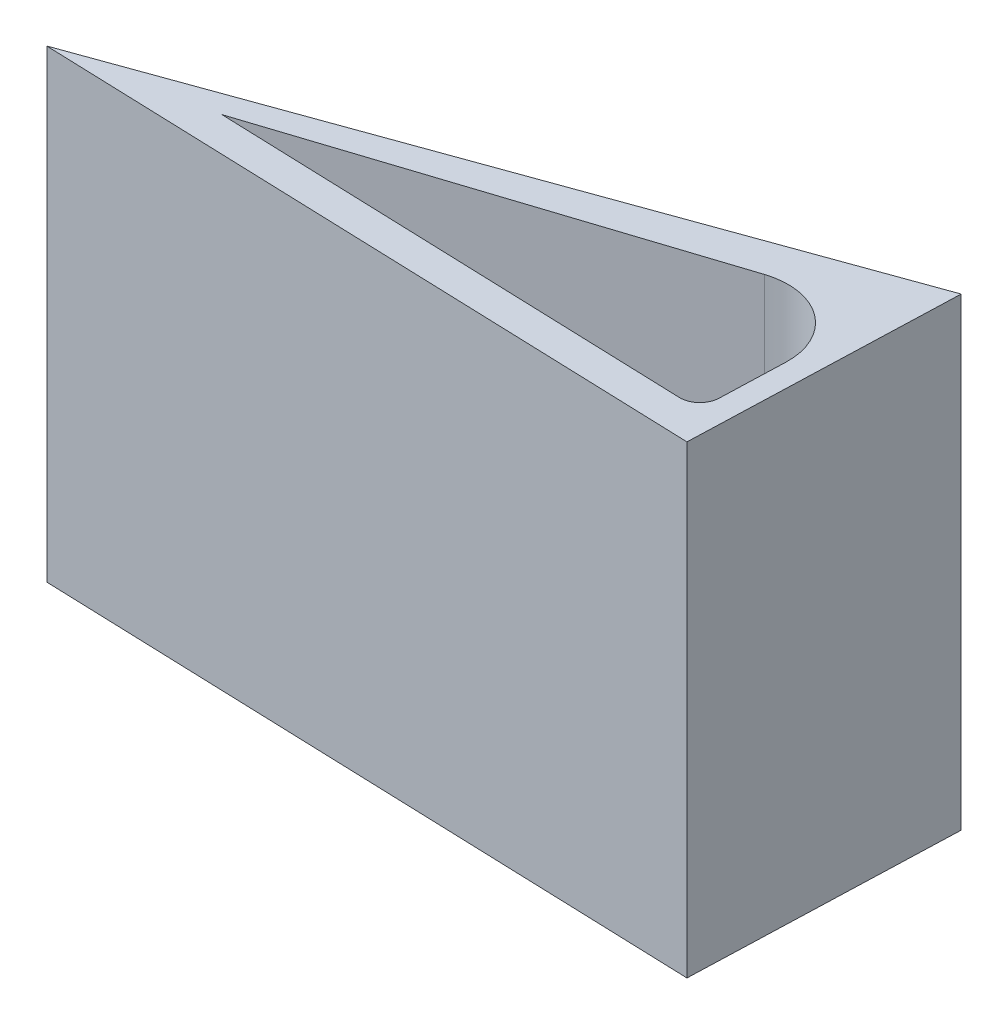
from build123d import *

# Parameters (mm, degrees)
EXTRUDE_2_DEPTH     = 70
CUT_EXTRUDE_1_DEPTH = 129.452325787
FILLET_1_R          = 10
FILLET_2_R          = 3


with BuildPart() as part:
    # 草图5 → 凸台-拉伸2 (new body)
    with BuildSketch(Plane(origin=(0, 0, 0), x_dir=(1, 0, 0), z_dir=(0, 1, 0))):
        Polygon((0, 0), (99.941085936, -3.432104596), (101.313927774, 36.544329779), align=None)
    extrude(amount=EXTRUDE_2_DEPTH)

    # 草图8 → 切除-拉伸1 (cut, through all)
    with BuildSketch(Plane.XZ):
        Polygon((97.48567579, -28.67108094), (96.55900755, -1.686987737), (22.158644136, -4.241991286), align=None)
    extrude(amount=-CUT_EXTRUDE_1_DEPTH, mode=Mode.SUBTRACT)

    # 圆角1
    fillet_1_edges = [part.edges().sort_by_distance(p)[0] for p in [
        (97.48567579, 35, -28.67108094),
    ]]
    fillet(fillet_1_edges, radius=FILLET_1_R)

    # 圆角2
    fillet_2_edges = [part.edges().sort_by_distance(p)[0] for p in [
        (96.55900755, 35, -1.686987737),
    ]]
    fillet(fillet_2_edges, radius=FILLET_2_R)


solid = part.part
